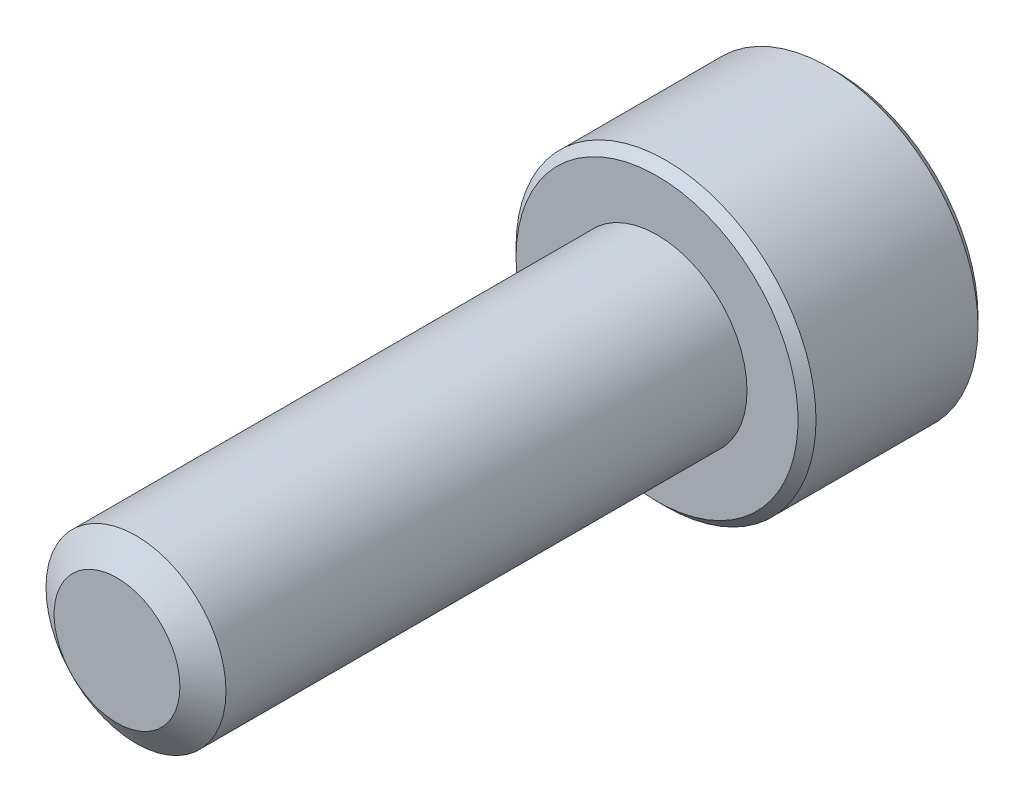
from build123d import *

# Parameters (mm, degrees)
SKETCH1_R          = 3
EXTRUDE1_DEPTH     = 18
SKETCH6_R          = 5
EXTRUDE2_DEPTH     = 6
CUT_EXTRUDE1_DEPTH = 3.75
CHAMFER1_SIZE      = 0.3


with BuildPart() as part:
    # Sketch1 → Extrude1 (new body)
    with BuildSketch(Plane.XY):
        Circle(SKETCH1_R)
    extrude(amount=-EXTRUDE1_DEPTH)

    # Sketch4 → Cut-Revolve1 (revolve, cut)
    with BuildSketch(Plane(origin=(0, 0, 0), x_dir=(0, 0, -1), z_dir=(1, 0, 0))):
        Polygon((0.632650852, 3), (0, 2.096480947), (0, 3), align=None)
    revolve(axis=Axis((0, 0, 0), (0, 0, -1)), mode=Mode.SUBTRACT)

    # Sketch6 → Extrude2 (add)
    with BuildSketch(Plane(origin=(0, 0, -18), x_dir=(-1, 0, 0), z_dir=(0, 0, -1))):
        Circle(SKETCH6_R)
    extrude(amount=EXTRUDE2_DEPTH)

    # Sketch7 → Cut-Extrude1 (cut)
    with BuildSketch(Plane(origin=(0, 0, -24), x_dir=(-1, 0, 0), z_dir=(0, 0, -1))):
        Polygon((0, 2.886751346), (-2.5, 1.443375673), (-2.5, -1.443375673), (0, -2.886751346), (2.5, -1.443375673), (2.5, 1.443375673), align=None)
    extrude(amount=-CUT_EXTRUDE1_DEPTH, mode=Mode.SUBTRACT)

    # Cut-Extrude2 cone 1 section (through the dimple's axis) → Cut-Extrude2 (revolve, cut)
    with BuildSketch(Plane(origin=(0, 0, -24), x_dir=(0, 1, 0), z_dir=(1, 0, 0))):
        Polygon((0, 0), (2.886751346, 0), (0, 2.886751346), align=None)
    revolve(axis=Axis((0, 0, -24), (0, 0, 1)), mode=Mode.SUBTRACT)

    # Chamfer1
    chamfer1_edges = [part.edges().sort_by_distance(p)[0] for p in [
        (5, 0, -24),
        (5, 0, -18),
    ]]
    chamfer(chamfer1_edges, length=CHAMFER1_SIZE)

    # Sketch10 → Revolve1 (revolve)
    with BuildSketch(Plane(origin=(0, 0, 0), x_dir=(0, 0, -1), z_dir=(1, 0, 0))):
        Polygon((18, 3), (18, 0), (16.507359313, 0), (17.75, 3), align=None)
    revolve(axis=Axis((0, 0, -18), (0, 0, 1)))


solid = part.part
